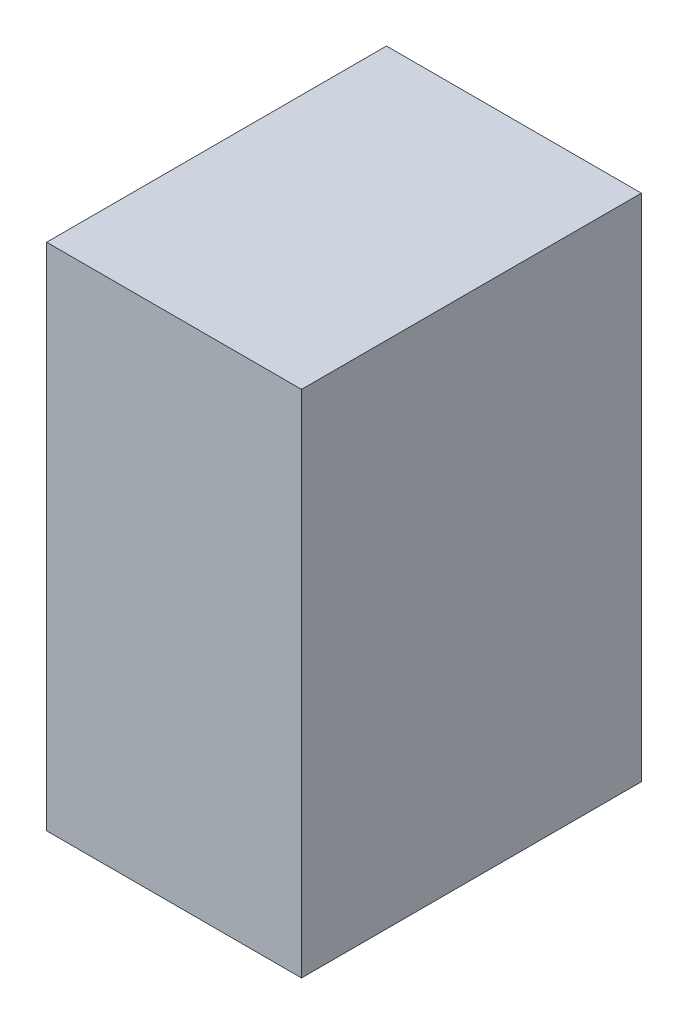
from build123d import *

# Parameters (mm, degrees)
CROQUIS1_W              = 6
CROQUIS1_H              = 12
SALIENTE_EXTRUIR1_DEPTH = 8


with BuildPart() as part:
    # Croquis1 → Saliente-Extruir1 (new body)
    with BuildSketch(Plane.XY):
        Rectangle(CROQUIS1_W, CROQUIS1_H)
    extrude(amount=SALIENTE_EXTRUIR1_DEPTH)


solid = part.part
